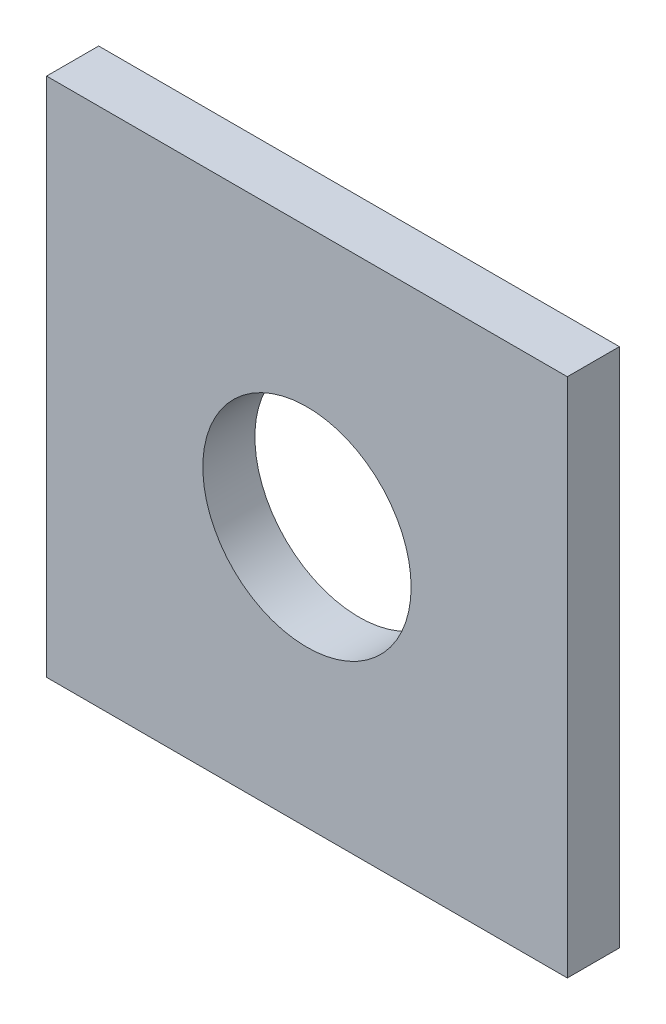
from build123d import *

# Parameters (mm, degrees)
CROQUIS1_W              = 100
CROQUIS1_H              = 100
SALIENTE_EXTRUIR1_DEPTH = 10
CORTAR_EXTRUIR1_REACH   = 73.414
CROQUIS2_R              = 20


with BuildPart() as part:
    # Croquis1 → Saliente-Extruir1 (new body)
    with BuildSketch(Plane.XY):
        Rectangle(CROQUIS1_W, CROQUIS1_H)
    extrude(amount=SALIENTE_EXTRUIR1_DEPTH)

    # Croquis2 → Cortar-Extruir1 (cut, up to next)
    with BuildSketch(Plane.XY.offset(10), mode=Mode.PRIVATE) as cortar_extruir1_sk1:
        Circle(CROQUIS2_R)
    cortar_extruir1_tool1 = extrude(cortar_extruir1_sk1.sketch, amount=-CORTAR_EXTRUIR1_REACH, mode=Mode.PRIVATE) & part.part
    add(cortar_extruir1_tool1.solids().sort_by_distance((0, 0, 10))[0], mode=Mode.SUBTRACT)


solid = part.part
